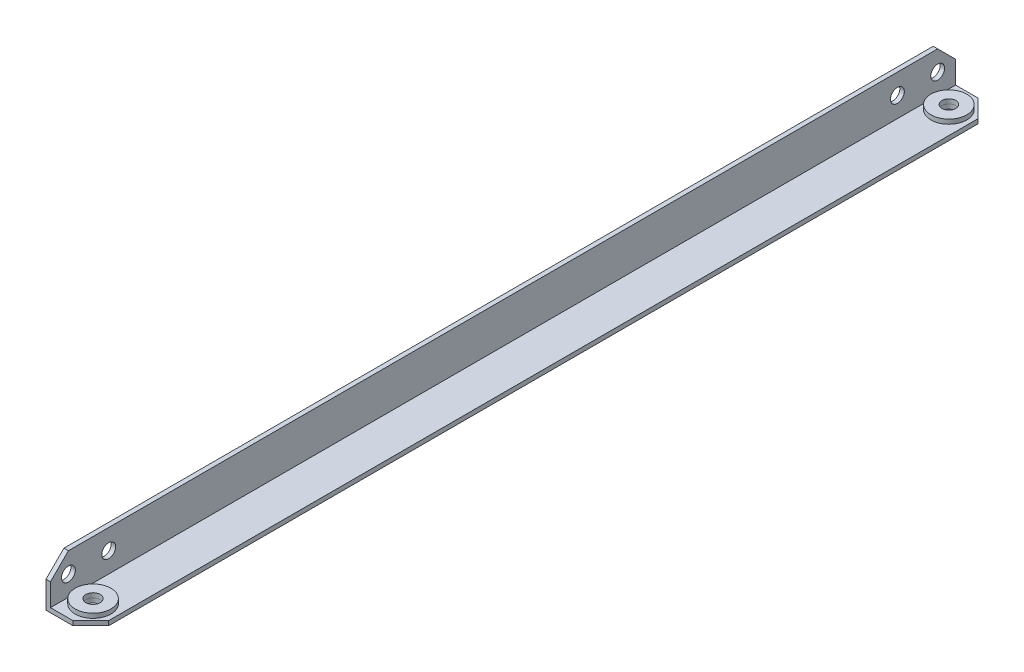
from build123d import *

# Parameters (mm, degrees)
SKETCH_1_W                = 100
SKETCH_1_H                = 100
EXTRUDE_1_DEPTH           = 2020
SKETCH_2_W                = 90
SKETCH_2_H                = 90
CUT_EXTRUDE_2_DEPTH       = 2025.944443682
SKETCH_3_R                = 15.5
CUT_EXTRUDE_3_DEPTH       = 2025.475240649
SKETCH_7_R                = 40
EXTRUDE_11_DEPTH          = 10
SKETCH_8_R                = 40
EXTRUDE_14_DEPTH          = 10
SKETCH_9_R                = 15.5
CUT_EXTRUDE_17_DEPTH      = 2025.055335212
SKETCH_11_R               = 16
CUT_EXTRUDE_18_DEPTH      = 2025.055335212
CUT_EXTRUDE_20_DEPTH      = 2025.475240649
CUT_EXTRUDE_20_DEPTH_BACK = 2025.475240649
CUT_EXTRUDE_21_DEPTH      = 2025.475240649
CUT_EXTRUDE_21_DEPTH_BACK = 2025.475240649
CUT_EXTRUDE_22_DEPTH      = 2025.475240649
CUT_EXTRUDE_22_DEPTH_BACK = 2025.475240649
CUT_EXTRUDE_23_DEPTH      = 2025.475240649
CUT_EXTRUDE_23_DEPTH_BACK = 2025.475240649


with BuildPart() as part:
    # 草图1 → 拉伸1 (new body)
    with BuildSketch(Plane.XY):
        with Locations((50, 50)):
            Rectangle(SKETCH_1_W, SKETCH_1_H)
    extrude(amount=EXTRUDE_1_DEPTH)

    # 草图2 → 拉伸2 (cut, through all)
    with BuildSketch(Plane.XY.offset(2020)):
        with Locations((55, 55)):
            Rectangle(SKETCH_2_W, SKETCH_2_H)
    extrude(amount=-CUT_EXTRUDE_2_DEPTH, mode=Mode.SUBTRACT)

    # 草图3 → 拉伸3 (cut, through all)
    with BuildSketch(Plane(origin=(10, 0, 0), x_dir=(0, 0, -1), z_dir=(1, 0, 0))):
        with Locations(Location((-1980, 55, 0), (0, 0, 90))):
            Circle(SKETCH_3_R)
        with Locations(Location((-1890, 55, 0), (0, 0, 90))):
            Circle(SKETCH_3_R)
        with Locations(Location((-130, 55, 0), (0, 0, 270))):
            Circle(SKETCH_3_R)
        with Locations(Location((-40, 55, 0), (0, 0, 270))):
            Circle(SKETCH_3_R)
    extrude(amount=-CUT_EXTRUDE_3_DEPTH, mode=Mode.SUBTRACT)


with BuildPart() as body_2:
    # 草图7 → 拉伸11 (new body)
    with BuildSketch(Plane(origin=(0, 10, 0), x_dir=(1, 0, 0), z_dir=(0, 1, 0))):
        with Locations(Location((50, -1965, 0), (0, 0, 180))):
            Circle(SKETCH_7_R)
    extrude(amount=EXTRUDE_11_DEPTH)


with BuildPart() as body_3:
    # 草图8 → 拉伸14 (new body)
    with BuildSketch(Plane(origin=(0, 10, 0), x_dir=(1, 0, 0), z_dir=(0, 1, 0))):
        with Locations(Location((50, -55, 0), (0, 0, 180))):
            Circle(SKETCH_8_R)
    extrude(amount=EXTRUDE_14_DEPTH)


with BuildPart() as cut_extrude_17_tool:
    # 草图9 → 拉伸17 (new, through all)
    with BuildSketch(Plane(origin=(0, 20, 0), x_dir=(1, 0, 0), z_dir=(0, 1, 0))):
        with Locations(Location((50, -55, 0), (0, 0, 180))):
            Circle(SKETCH_9_R)
    extrude(amount=-CUT_EXTRUDE_17_DEPTH)


with BuildPart() as part_1:
    add(part.part)

    # 拉伸17: cut by cut_extrude_17_tool
    add(cut_extrude_17_tool.part, mode=Mode.SUBTRACT)


with BuildPart() as body_3_1:
    add(body_3.part)

    # 拉伸17: cut by cut_extrude_17_tool
    add(cut_extrude_17_tool.part, mode=Mode.SUBTRACT)


with BuildPart() as cut_extrude_18_tool:
    # 草图11 → 拉伸18 (new, through all)
    with BuildSketch(Plane(origin=(0, 20, 0), x_dir=(1, 0, 0), z_dir=(0, 1, 0))):
        with Locations(Location((50, -1965, 0), (0, 0, 180))):
            Circle(SKETCH_11_R)
    extrude(amount=-CUT_EXTRUDE_18_DEPTH)


with BuildPart() as part_2:
    add(part_1.part)

    # 拉伸18: cut by cut_extrude_18_tool
    add(cut_extrude_18_tool.part, mode=Mode.SUBTRACT)

    # 草图15 → 拉伸20 (cut, two sides: drawn at the far end of the back side and taken through both)
    with BuildSketch(Plane(origin=(0, 10, 0), x_dir=(1, 0, 0), z_dir=(0, 1, 0)).offset(-CUT_EXTRUDE_20_DEPTH_BACK)):
        Polygon((-2805.042376275, -4885.042376275), (60, -2020), (100, -1980), (2965.042376275, 885.042376275), (8695.127128826, -4845.042376275), (2925.042376275, -10615.127128826), align=None)
    extrude(amount=CUT_EXTRUDE_20_DEPTH + CUT_EXTRUDE_20_DEPTH_BACK, mode=Mode.SUBTRACT)

    # 草图17 → 拉伸21 (cut, two sides: drawn at the far end of the back side and taken through both)
    with BuildSketch(Plane(origin=(0, 10, 0), x_dir=(1, 0, 0), z_dir=(0, 1, 0)).offset(-CUT_EXTRUDE_21_DEPTH_BACK)):
        Polygon((-2805.042376275, 2865.042376275), (60, 0), (100, -40), (2965.042376275, -2905.042376275), (8695.127128826, 2825.042376275), (2925.042376275, 8595.127128826), align=None)
    extrude(amount=CUT_EXTRUDE_21_DEPTH + CUT_EXTRUDE_21_DEPTH_BACK, mode=Mode.SUBTRACT)

    # 草图18 → 拉伸22 (cut, two sides: drawn at the far end of the back side and taken through both)
    with BuildSketch(Plane(origin=(10, 0, 0), x_dir=(0, 0, -1), z_dir=(1, 0, 0)).offset(-CUT_EXTRUDE_22_DEPTH_BACK)):
        Polygon((-2905.042376275, 2965.042376275), (-40, 100), (0, 60), (2865.042376275, -2805.042376275), (8595.127128826, 2925.042376275), (2825.042376275, 8695.127128826), align=None)
    extrude(amount=CUT_EXTRUDE_22_DEPTH + CUT_EXTRUDE_22_DEPTH_BACK, mode=Mode.SUBTRACT)

    # 草图19 → 拉伸23 (cut, two sides: drawn at the far end of the back side and taken through both)
    with BuildSketch(Plane(origin=(10, 0, 0), x_dir=(0, 0, -1), z_dir=(1, 0, 0)).offset(-CUT_EXTRUDE_23_DEPTH_BACK)):
        Polygon((-4885.042376275, -2805.042376275), (-2020, 60), (-1980, 100), (885.042376275, 2965.042376275), (-4845.042376275, 8695.127128826), (-10615.127128826, 2925.042376275), align=None)
    extrude(amount=CUT_EXTRUDE_23_DEPTH + CUT_EXTRUDE_23_DEPTH_BACK, mode=Mode.SUBTRACT)


with BuildPart() as body_2_1:
    add(body_2.part)

    # 拉伸18: cut by cut_extrude_18_tool
    add(cut_extrude_18_tool.part, mode=Mode.SUBTRACT)


solid = Compound([body_3_1.part, part_2.part, body_2_1.part])
